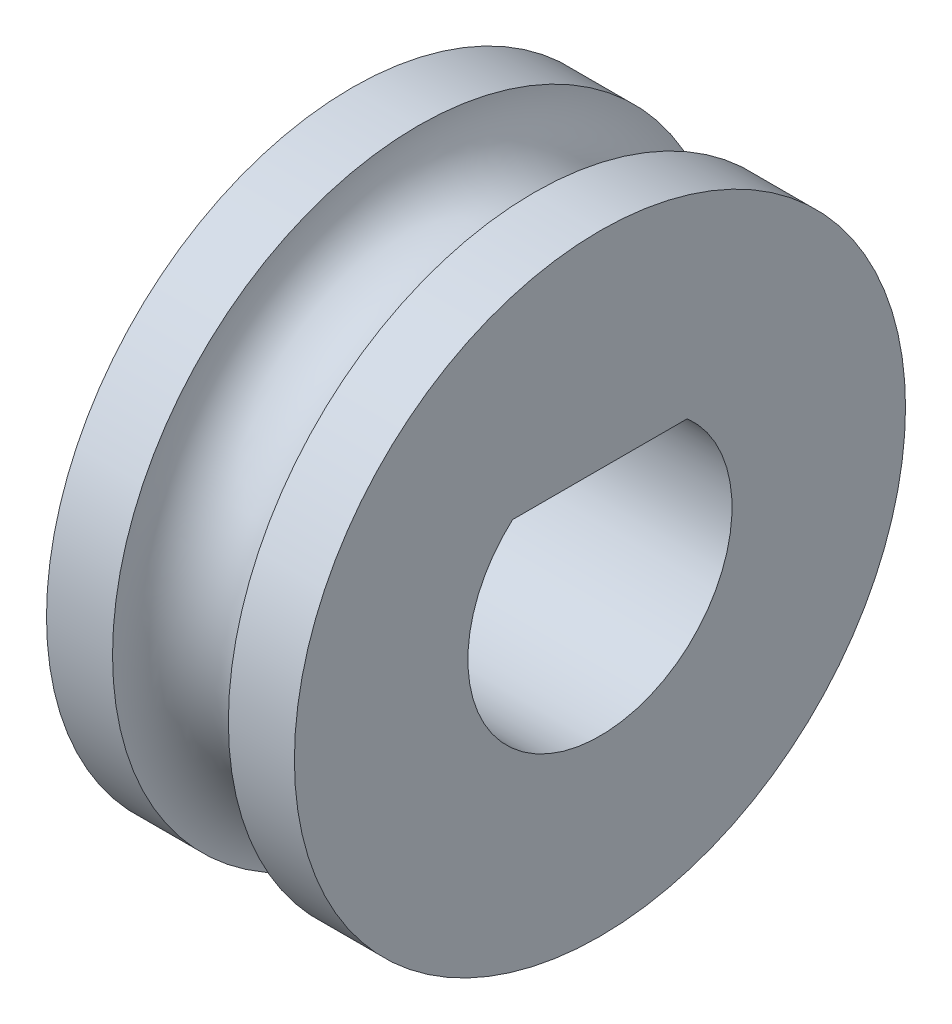
from build123d import *

# Parameters (mm, degrees)
CUT_EXTRUDE1_DEPTH  = 14.549134849
BOSS_EXTRUDE1_START = 2
SKETCH5_R           = 9.254000034
BOSS_EXTRUDE1_DEPTH = 2


with BuildPart() as part:
    # Sketch3 → Revolve1 (revolve)
    with BuildSketch(Plane.XY):
        with BuildLine():
            Line((1.753997, 0), (-1.753997, 0))
            Line((-1.753997, 0), (-1.753997, 9.254000034))
            ThreePointArc((-1.753997, 9.254000034), (0, 7.500003034), (1.753997, 9.254000034))
            Line((1.753997, 9.254000034), (1.753997, 0))
        make_face()
    revolve(axis=Axis((1.753997, 0, 0), (-1, 0, 0)))

    # Sketch4 → Cut-Extrude1 (cut, through all)
    with BuildSketch(Plane.ZY.offset(1.753997)):
        with BuildLine():
            Line((0, 3), (-2.645751311, 3))
            ThreePointArc((-2.645751311, 3), (0, -4), (2.645751311, 3))
            Line((2.645751311, 3), (0, 3))
        make_face()
    extrude(amount=-CUT_EXTRUDE1_DEPTH, mode=Mode.SUBTRACT)

    # Sketch5 → Boss-Extrude1 (add)
    with BuildSketch(Plane.ZY.offset(1.753997).offset(BOSS_EXTRUDE1_START)):
        Circle(SKETCH5_R)
        with BuildLine():
            Line((2.645751311, 3), (-2.645751311, 3))
            ThreePointArc((-2.645751311, 3), (0, -4), (2.645751311, 3))
        make_face(mode=Mode.SUBTRACT)
    boss_extrude1 = extrude(amount=-BOSS_EXTRUDE1_DEPTH)

    # Mirror1: Boss-Extrude1 across plane
    add(boss_extrude1.mirror(Plane(origin=(0, 0, 0), x_dir=(0, 0, 1), z_dir=(1, 0, 0))))


solid = part.part
